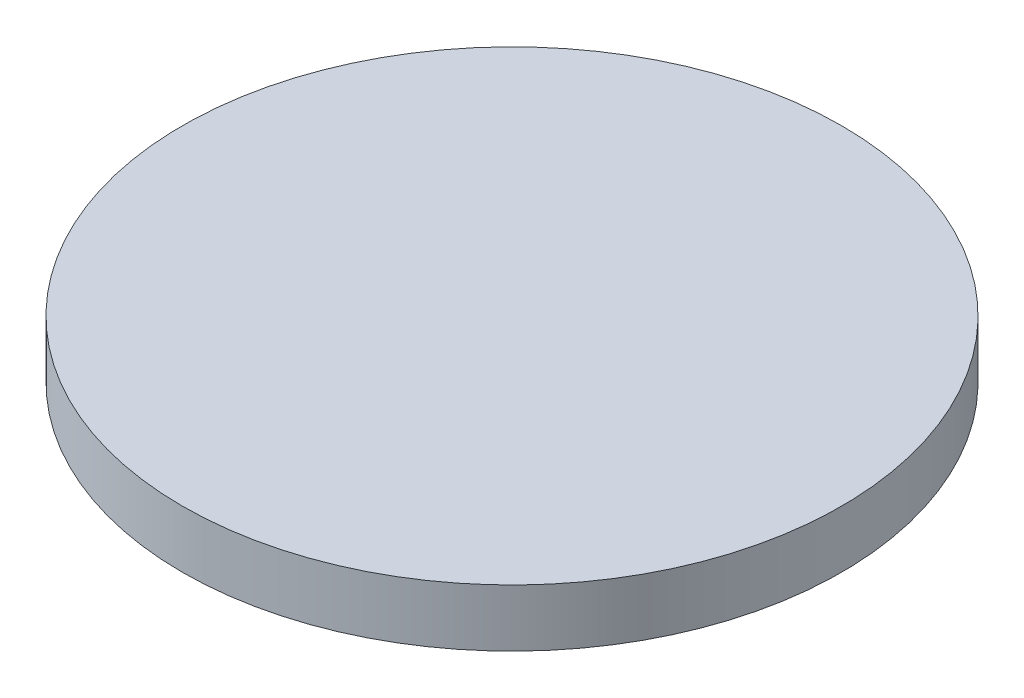
from build123d import *

# Parameters (mm, degrees)
SKETCH_1_R      = 23
EXTRUDE_1_DEPTH = 4


with BuildPart() as part:
    # Эскиз1 → Бобышка-Вытянуть1 (new body)
    with BuildSketch(Plane(origin=(0, 0, 0), x_dir=(1, 0, 0), z_dir=(0, 1, 0))):
        with Locations(Location((0, 0, 0), (0, 0, 270))):
            Circle(SKETCH_1_R)
    extrude(amount=EXTRUDE_1_DEPTH)


solid = part.part
